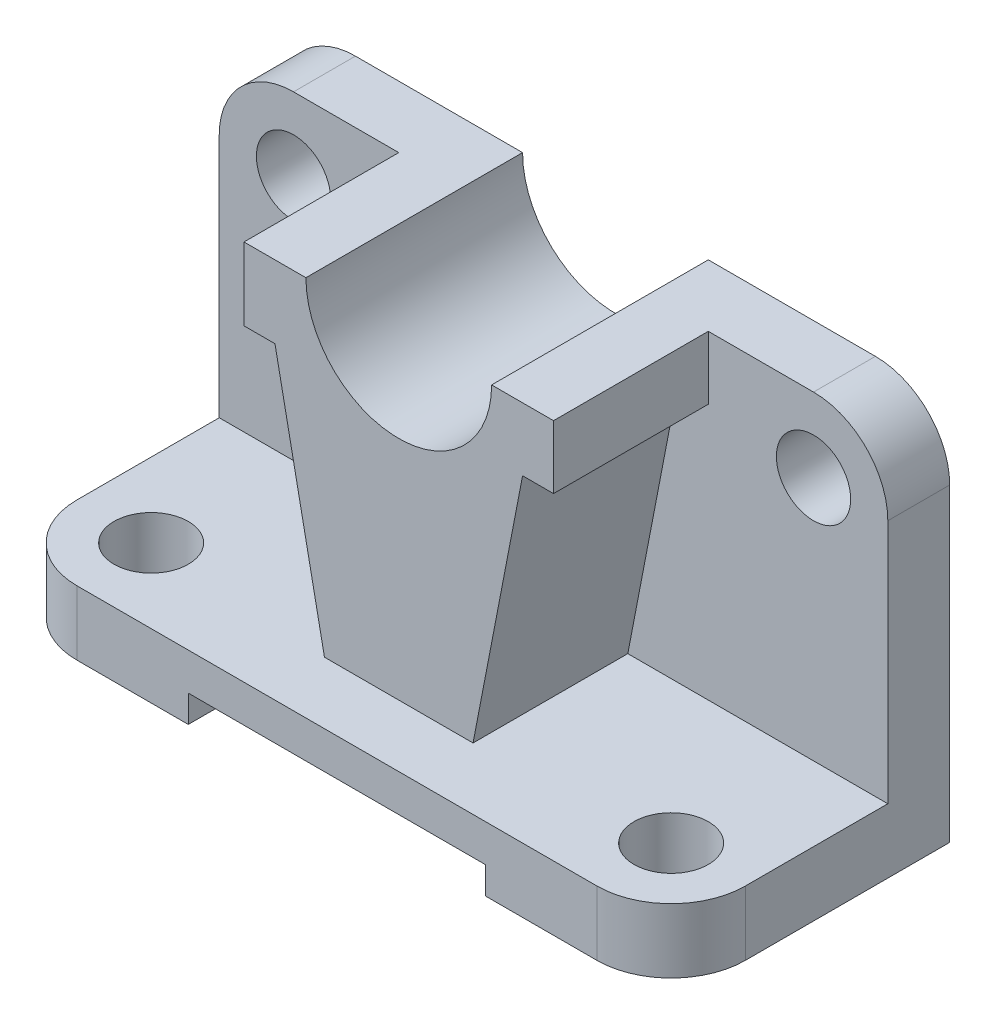
from build123d import *

# Parameters (mm, degrees)
BOSS_EXTRUDE1_DEPTH     = 45
SKETCH1_3_R             = 6
BOSS_EXTRUDE2_DEPTH     = 10
BOSS_EXTRUDE3_DEPTH     = 35
FILLET1_R               = 12
FILLET2_R               = 12
FILLET3_R               = 12
CUT_EXTRUDE1_DEPTH      = 128.869924602
CUT_EXTRUDE1_DEPTH_BACK = 128.869924602
SKETCH2_R               = 6


with BuildPart() as part:
    # Sketch1 → Boss-Extrude1 (new body)
    with BuildSketch(Plane.XY):
        Polygon((0, 10.408163265), (0, 0), (30, 0), (30, 4.387755102), (78, 4.387755102), (78, 0), (108, 0), (108, 10.408163265), align=None)
    extrude(amount=BOSS_EXTRUDE1_DEPTH)

    # Sketch1<3> → Boss-Extrude2 (add)
    # profile 1 of 2: a face of its own
    with BuildSketch(Plane.XY):
        Polygon((0, 62), (0, 10.408163265), (42, 10.408163265), (34, 50.265306122), (29, 50.265306122), (29, 62), align=None)
        with Locations((12, 50)):
            Circle(SKETCH1_3_R, mode=Mode.SUBTRACT)
    # profile 2 of 2: a face of its own
    with BuildSketch(Plane.XY):
        Polygon((74, 51.795918367), (66, 10.408163265), (108, 10.408163265), (108, 62), (79, 62), (79, 51.795918367), align=None)
        with Locations((96, 50)):
            Circle(SKETCH1_3_R, mode=Mode.SUBTRACT)
    extrude(amount=BOSS_EXTRUDE2_DEPTH)

    # Sketch1<4> → Boss-Extrude3 (add)
    with BuildSketch(Plane.XY):
        with BuildLine():
            Line((34, 50.265306122), (42, 10.408163265))
            Line((42, 10.408163265), (66, 10.408163265))
            Line((66, 10.408163265), (74, 51.795918367))
            Line((74, 51.795918367), (79, 51.795918367))
            Line((79, 51.795918367), (79, 62))
            Line((79, 62), (69, 62))
            ThreePointArc((69, 62), (54, 47), (39, 62))
            Line((39, 62), (29, 62))
            Line((29, 62), (29, 50.265306122))
            Line((29, 50.265306122), (34, 50.265306122))
        make_face()
    extrude(amount=BOSS_EXTRUDE3_DEPTH)

    # Fillet1
    fillet1_edges = [part.edges().sort_by_distance(p)[0] for p in [
        (0, 62, 5),
    ]]
    fillet(fillet1_edges, radius=FILLET1_R)

    # Fillet2
    fillet2_edges = [part.edges().sort_by_distance(p)[0] for p in [
        (108, 62, 5),
    ]]
    fillet(fillet2_edges, radius=FILLET2_R)

    # Fillet3
    fillet3_edges = [part.edges().sort_by_distance(p)[0] for p in [
        (108, 5.204081633, 45),
        (0, 5.204081633, 45),
    ]]
    fillet(fillet3_edges, radius=FILLET3_R)

    # Sketch2 → Cut-Extrude1 (cut, two sides: drawn at the far end of the back side and taken through both)
    with BuildSketch(Plane(origin=(0, 10.408163265, 0), x_dir=(1, 0, 0), z_dir=(0, 1, 0)).offset(-CUT_EXTRUDE1_DEPTH_BACK)):
        with Locations((12, -33)):
            Circle(SKETCH2_R)
        with Locations((96, -33)):
            Circle(SKETCH2_R)
    extrude(amount=CUT_EXTRUDE1_DEPTH + CUT_EXTRUDE1_DEPTH_BACK, mode=Mode.SUBTRACT)


solid = part.part
